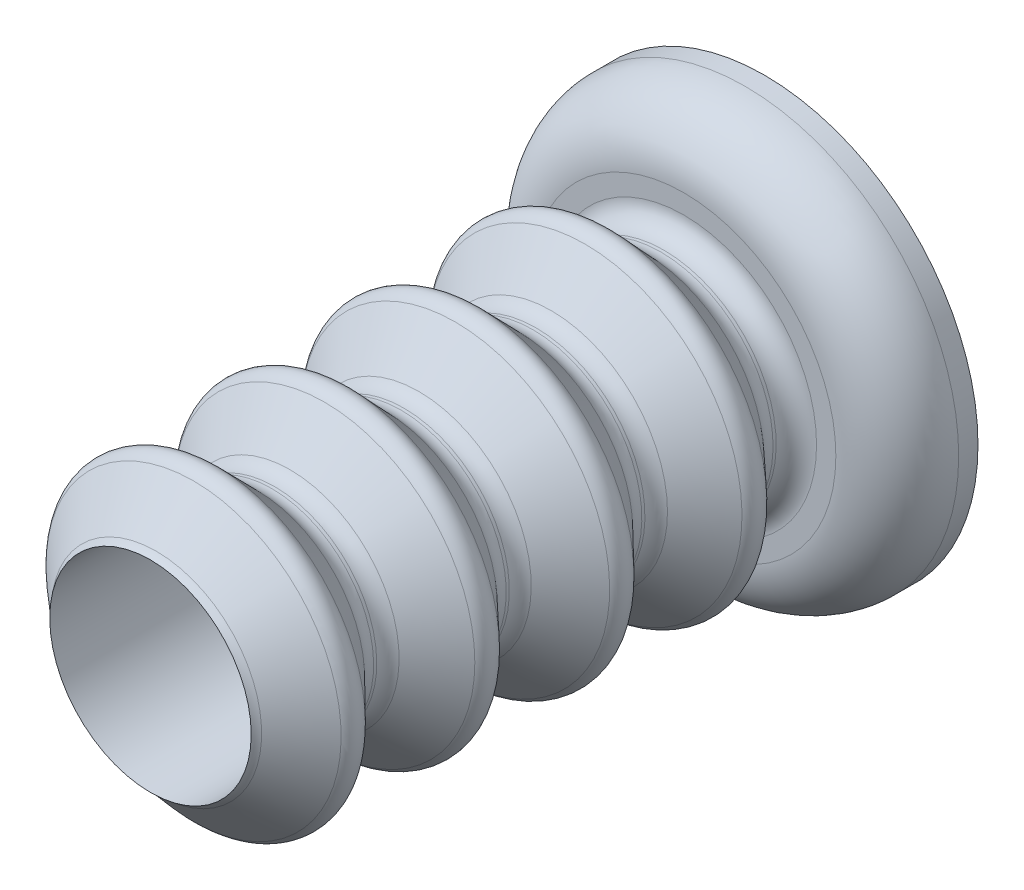
from build123d import *

# Parameters (mm, degrees)
SKETCH21_R         = 12.5
CUT_EXTRUDE1_DEPTH = 106.677579344


with BuildPart() as part:
    # Sketch20 → Revolve5 (revolve)
    with BuildSketch(Plane(origin=(0, 0, 0), x_dir=(0, 0, -1), z_dir=(1, 0, 0))):
        with BuildLine():
            ThreePointArc((-149.86635702, 16.473293589), (-150.586568795, 14.701297309), (-152.338774985, 13.934192829))
            Line((-152.338774985, 13.934192829), (-152.716566296, 13.924137338))
            ThreePointArc((-152.716566296, 13.924137338), (-153.768905768, 14.121902412), (-154.646241622, 14.735751896))
            Line((-154.646241622, 14.735751896), (-159.110721109, 19.548107151))
            ThreePointArc((-159.110721109, 19.548107151), (-160.630150499, 20.187173732), (-162.113433189, 19.468185394))
            Line((-162.113433189, 19.468185394), (-166.315596551, 14.425154235))
            ThreePointArc((-166.315596551, 14.425154235), (-167.159036261, 13.765503688), (-168.199365567, 13.512039046))
            Line((-168.199365567, 13.512039046), (-168.577156878, 13.501983554))
            ThreePointArc((-168.577156878, 13.501983554), (-169.603776658, 13.689096516), (-170.468521369, 14.273199263))
            Line((-170.468521369, 14.273199263), (-175.267267946, 19.223673735))
            ThreePointArc((-175.267267946, 19.223673735), (-176.756531325, 19.830930199), (-178.211382865, 19.145311631))
            Line((-178.211382865, 19.145311631), (-182.739992735, 13.946575356))
            ThreePointArc((-182.739992735, 13.946575356), (-183.572441518, 13.317299218), (-184.587654191, 13.075839775))
            Line((-184.587654191, 13.075839775), (-184.965445502, 13.065784283))
            ThreePointArc((-184.965445502, 13.065784283), (-186.009680025, 13.260156931), (-186.88312503, 13.864557699))
            Line((-186.88312503, 13.864557699), (-191.451654285, 18.721244315))
            ThreePointArc((-191.451654285, 18.721244315), (-192.961638166, 19.35019976), (-194.436026585, 18.641810699))
            Line((-194.436026585, 18.641810699), (-198.73973417, 13.548975982))
            ThreePointArc((-198.73973417, 13.548975982), (-199.579791169, 12.898967748), (-200.612207462, 12.649321875))
            Line((-200.612207462, 12.649321875), (-200.989998773, 12.639266383))
            ThreePointArc((-200.989998773, 12.639266383), (-202.00935399, 12.823430241), (-202.870414529, 13.399256719))
            Line((-202.870414529, 13.399256719), (-207.765783323, 18.387417939))
            ThreePointArc((-207.765783323, 18.387417939), (-209.246425651, 18.985835526), (-210.693138533, 18.30950192))
            Line((-210.693138533, 18.30950192), (-215.316229055, 13.067992403))
            ThreePointArc((-215.316229055, 13.067992403), (-216.145439142, 12.447176797), (-217.153554415, 12.209048723))
            Line((-217.153554415, 12.209048723), (-217.531345726, 12.198993232))
            ThreePointArc((-217.531345726, 12.198993232), (-218.603121904, 12.4050286), (-219.489494365, 13.041816327))
            Line((-219.489494365, 13.041816327), (-223.709085468, 17.744712666))
            ThreePointArc((-223.709085468, 17.744712666), (-225.25093479, 18.408352899), (-226.755298463, 17.663633066))
            Line((-226.755298463, 17.663633066), (-230.718742879, 12.742932769))
            ThreePointArc((-230.718742879, 12.742932769), (-231.569986193, 12.05989575), (-232.629284744, 11.797138582))
            ThreePointArc((-232.629284744, 11.797138582), (-237.34867537, 6.776119986), (-238.600663215, 0))
            Line((-238.600663215, 0), (-139.849490611, 0))
            Line((-139.849490611, 0), (-139.849490611, 26.487002499))
            Line((-139.849490611, 26.487002499), (-142.24635702, 26.487002499))
            ThreePointArc((-142.24635702, 26.487002499), (-147.634510692, 24.255156171), (-149.86635702, 18.867002499))
            Line((-149.86635702, 18.867002499), (-149.86635702, 16.473293589))
        make_face()
    revolve(axis=Axis((0, 0, 139.849490611), (0, 0, 1)))

    # Sketch21 → Cut-Extrude1 (cut, through all)
    with BuildSketch(Plane(origin=(0, 0, 139.849490611), x_dir=(-1, 0, 0), z_dir=(0, 0, -1))):
        Circle(SKETCH21_R)
    extrude(amount=-CUT_EXTRUDE1_DEPTH, mode=Mode.SUBTRACT)


with BuildPart() as body_2:
    # of the pieces the cut leaves, the one that is kept (cut_extrude1_keep)
    add(part.part.solids().sort_by_distance((0, 26.487002499, 142.24635702))[0])


solid = body_2.part
